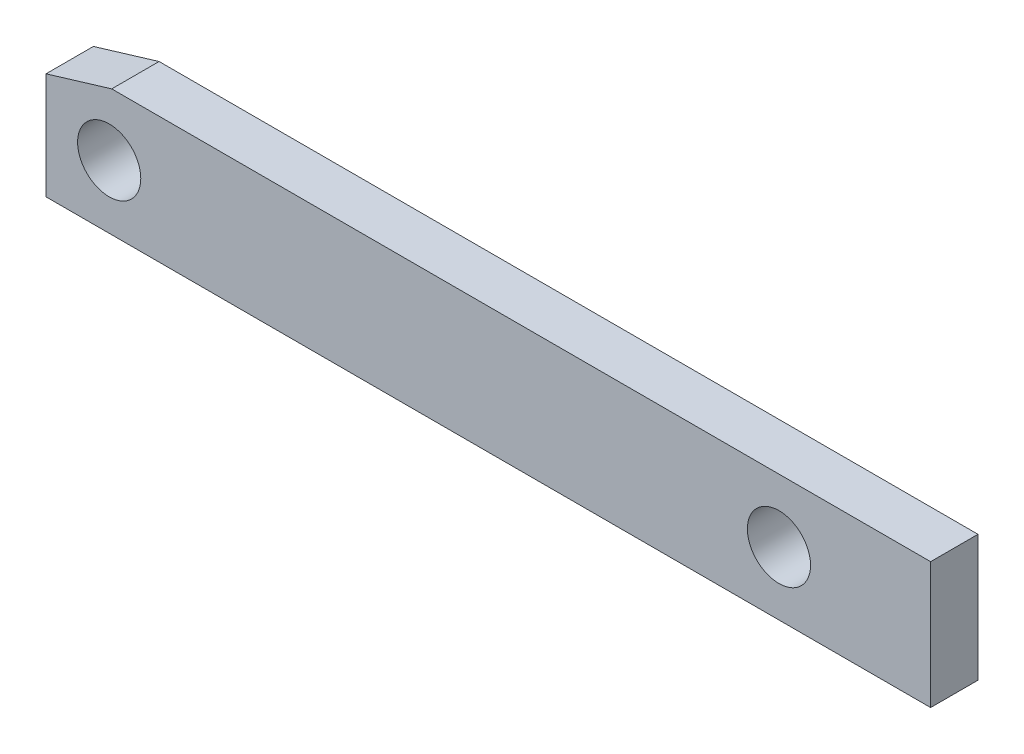
from build123d import *

# Parameters (mm, degrees)
SKETCH1_W                  = 177.8
SKETCH1_H                  = 25.4
BOSS_EXTRUDE1_DEPTH        = 9.525
F_1_2_0_5_DIAMETER_HOLE1_D = 12.7
CUT_EXTRUDE1_DEPTH         = 180.857514786


with BuildPart() as part:
    # Sketch1 → Boss-Extrude1 (new body)
    with BuildSketch(Plane.XY):
        with Locations((88.9, 12.7)):
            Rectangle(SKETCH1_W, SKETCH1_H)
    extrude(amount=BOSS_EXTRUDE1_DEPTH)

    # 1/2 (0.5) Diameter Hole1 (through all)
    with Locations(Plane.XY.offset(9.525)):
        with Locations((12.7, 12.7), (147.32, 12.7)):
            Hole(F_1_2_0_5_DIAMETER_HOLE1_D / 2)

    # Sketch5 → Cut-Extrude1 (cut, through all)
    with BuildSketch(Plane.XY.offset(9.525)):
        Polygon((13.208, 25.4), (0, 21.419090106), (0, 25.4), align=None)
    extrude(amount=-CUT_EXTRUDE1_DEPTH, mode=Mode.SUBTRACT)


solid = part.part
